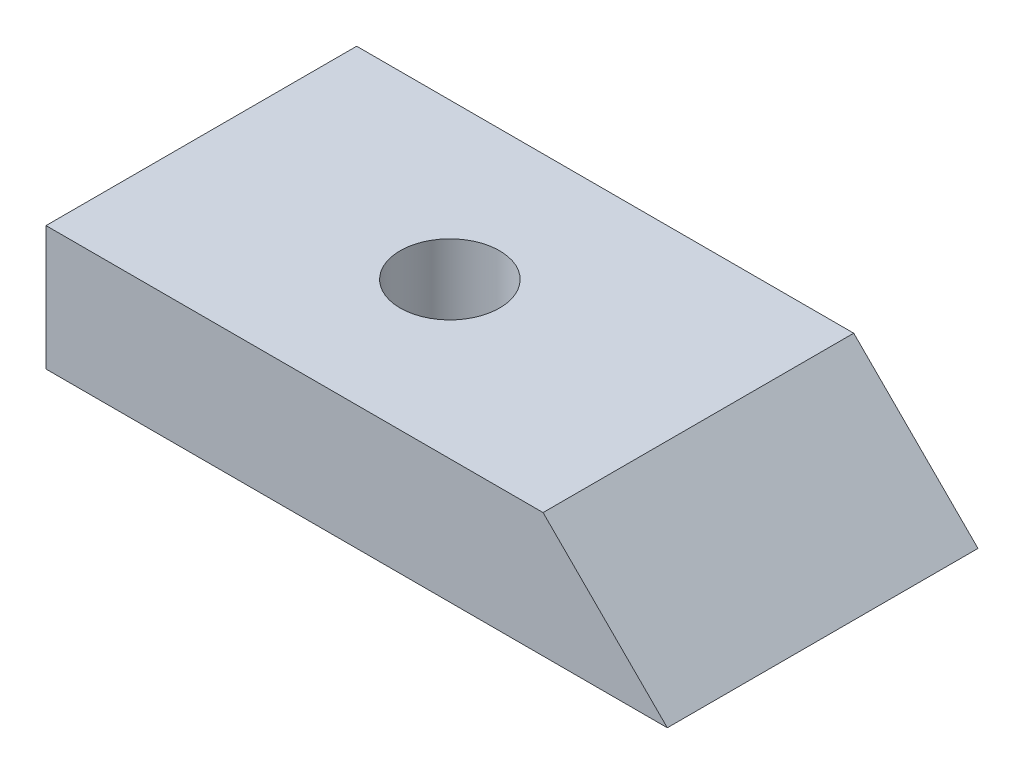
from build123d import *

# Parameters (mm, degrees)
BOSS_EXTRUDE1_DEPTH = 12.5
SKETCH2_R           = 4
CUT_EXTRUDE1_DEPTH  = 25


with BuildPart() as part:
    # Sketch1 → Boss-Extrude1 (new, symmetric)
    with BuildSketch(Plane.XY):
        Polygon((15, 0), (25, 0), (15, 10), (-25, 10), (-25, 0), align=None)
    extrude(amount=BOSS_EXTRUDE1_DEPTH, both=True)

    # Sketch2 → Cut-Extrude1 (cut)
    with BuildSketch(Plane(origin=(0, 10, 0), x_dir=(1, 0, 0), z_dir=(0, 1, 0))):
        with Locations(Location((-5, 0, 0), (0, 0, 270))):
            Circle(SKETCH2_R)
    extrude(amount=-CUT_EXTRUDE1_DEPTH, mode=Mode.SUBTRACT)


solid = part.part
